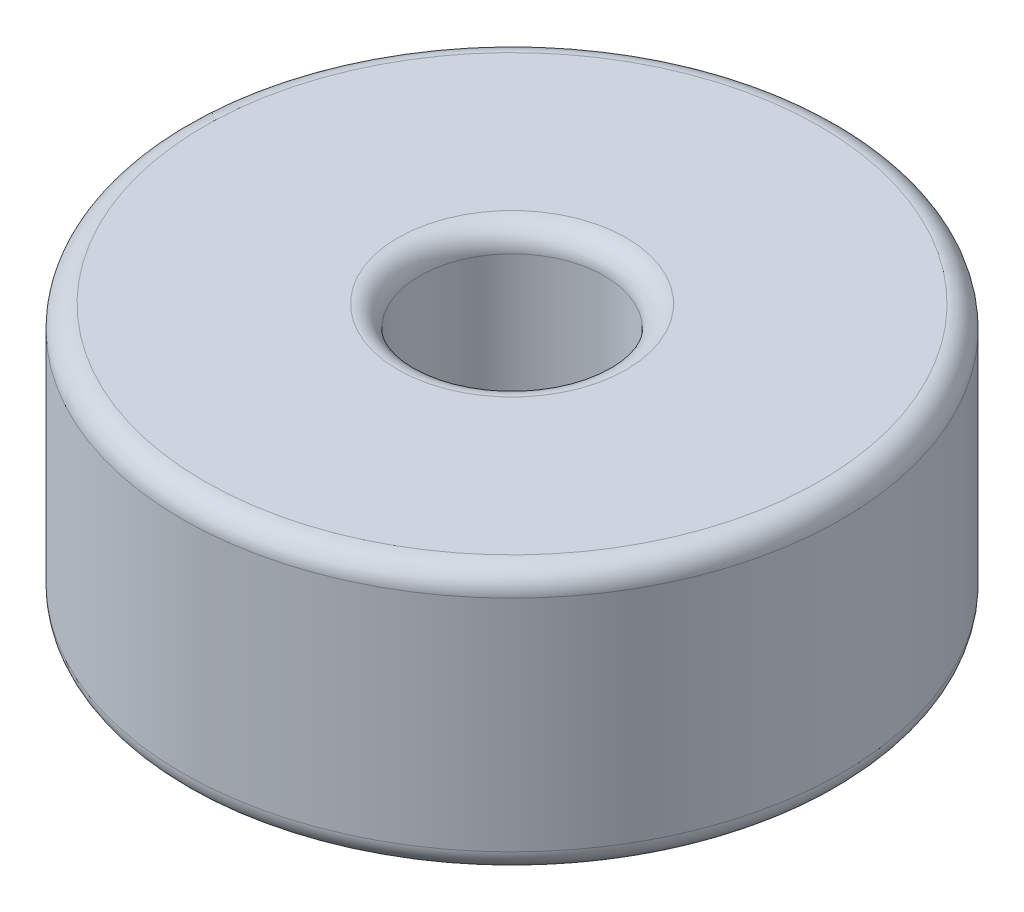
from build123d import *

# Parameters (mm, degrees)
SKETCH1_R           = 7.5
SKETCH1_R_2         = 2.1
BOSS_EXTRUDE1_DEPTH = 6
FILLET1_R           = 0.5


with BuildPart() as part:
    # Sketch1 → Boss-Extrude1 (new body)
    with BuildSketch(Plane(origin=(0, 0, 0), x_dir=(1, 0, 0), z_dir=(0, 1, 0))):
        with Locations(Location((0, 0, 0), (0, 0, 270))):
            Circle(SKETCH1_R)
        with Locations(Location((0, 0, 0), (0, 0, 270))):
            Circle(SKETCH1_R_2, mode=Mode.SUBTRACT)
    extrude(amount=BOSS_EXTRUDE1_DEPTH)

    # Fillet1
    fillet1_edges = [part.edges().sort_by_distance(p)[0] for p in [
        (0, 0, -7.5),
        (0, 6, -7.5),
        (0, 0, -2.1),
        (0, 6, -2.1),
    ]]
    fillet(fillet1_edges, radius=FILLET1_R)


solid = part.part
